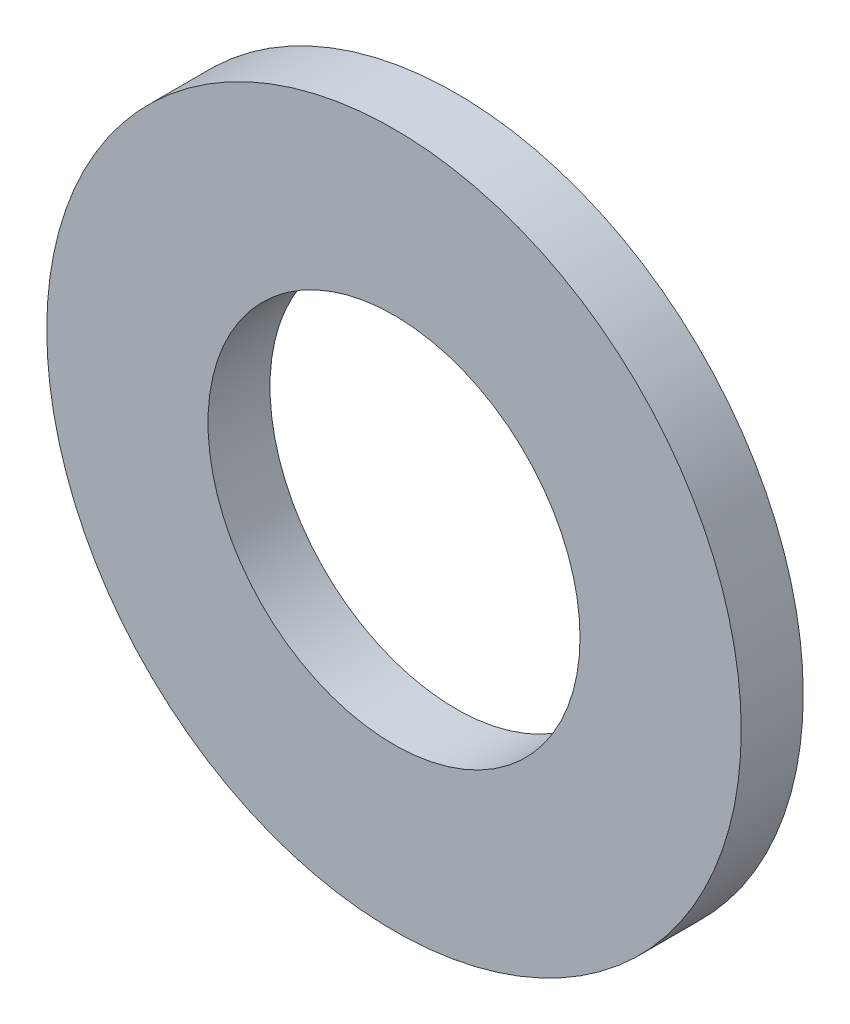
from build123d import *

# Parameters (mm, degrees)
SKETCH1_R          = 14
SKETCH1_R_2        = 7.5
BASE_EXTRUDE_DEPTH = 2.5


with BuildPart() as part:
    # Sketch1 → Base-Extrude (new body)
    with BuildSketch(Plane.XY):
        Circle(SKETCH1_R)
        Circle(SKETCH1_R_2, mode=Mode.SUBTRACT)
    extrude(amount=-BASE_EXTRUDE_DEPTH)


solid = part.part
